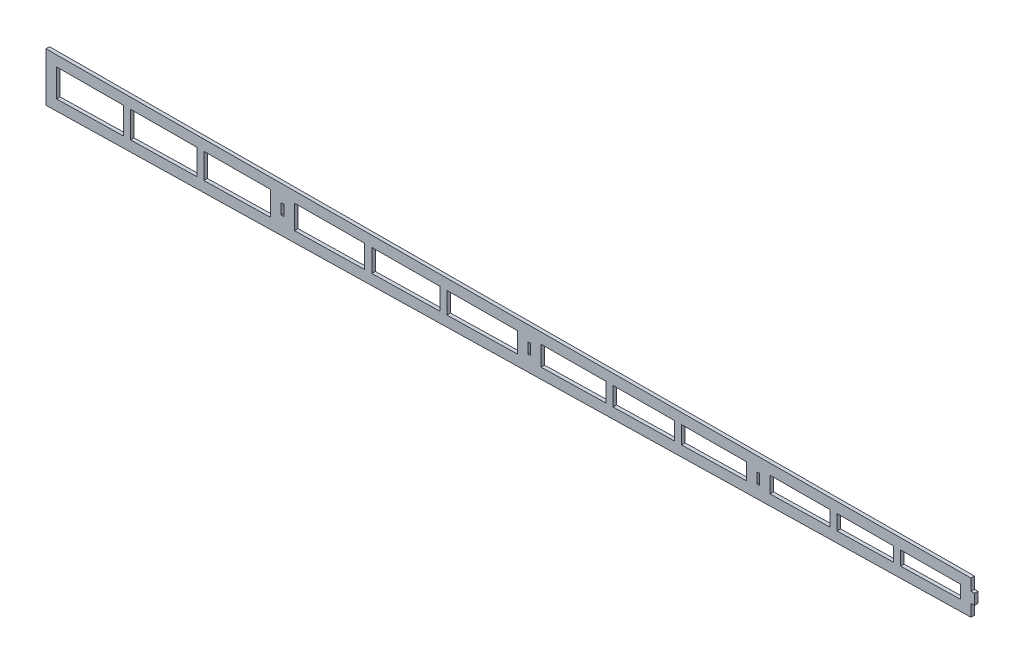
from build123d import *

# Parameters (mm, degrees)
SKETCH_1_W      = 1.499999968
SKETCH_1_H      = 6.000000011
SKETCH_1_H_2    = 6.00000001
SKETCH_1_W_2    = 1.5
SKETCH_1_H_3    = 6
EXTRUDE_1_DEPTH = 2


with BuildPart() as part:
    # 草图1 → 凸台-拉伸1 (new body)
    with BuildSketch(Plane.XY):
        Polygon((537.351209242, 34.194218327), (539.351209242, 34.194218327), (539.351209242, 28.194218337), (537.351209274, 28.194218337), (537.351209274, 21.391410378), (11.364676515, 10.534074896), (11.364676515, 38.388326082), (537.351216266, 40.712891717), align=None)
        with Locations((416.371863849, 29.143567663)):
            Rectangle(SKETCH_1_W, SKETCH_1_H, mode=Mode.SUBTRACT)
        with Locations((286.128813818, 28.050804453)):
            Rectangle(SKETCH_1_W, SKETCH_1_H_2, mode=Mode.SUBTRACT)
        with Locations((145.867074626, 26.415625273)):
            Rectangle(SKETCH_1_W_2, SKETCH_1_H_3, mode=Mode.SUBTRACT)
        Polygon((531.351209242, 34.686316456), (531.351209242, 27.268837395), (497.351863833, 26.567027983), (497.351863833, 34.536058409), align=None, mode=Mode.SUBTRACT)
        Polygon((493.351863833, 26.48446058), (461.121863833, 25.819173732), (461.121863833, 34.37594212), (493.351863833, 34.518380652), align=None, mode=Mode.SUBTRACT)
        Polygon((457.121863833, 25.736606329), (423.121863833, 25.034783405), (423.121863833, 34.208003423), (457.121863833, 34.358264363), align=None, mode=Mode.SUBTRACT)
        Polygon((409.621863833, 34.148340991), (409.621863833, 24.75611842), (372.718813802, 23.994371171), (372.718813802, 33.985250198), align=None, mode=Mode.SUBTRACT)
        Polygon((368.718813802, 23.911803768), (333.778813802, 23.190577505), (333.778813802, 33.813157228), (368.718813802, 33.967572441), align=None, mode=Mode.SUBTRACT)
        Polygon((329.778813802, 23.108010102), (292.878813802, 22.346325811), (292.878813802, 33.632402157), (329.778813802, 33.79547947), align=None, mode=Mode.SUBTRACT)
        Polygon((279.378813802, 33.572739725), (279.378813802, 22.067660826), (239.377074626, 21.241950898), (239.377074626, 33.395954463), align=None, mode=Mode.SUBTRACT)
        Polygon((235.377074626, 21.159383496), (196.617074626, 20.359305362), (196.617074626, 33.206979234), (235.377074626, 33.378276705), align=None, mode=Mode.SUBTRACT)
        Polygon((192.617074626, 20.276737959), (152.617074626, 19.451063931), (152.617074626, 33.012523901), (192.617074626, 33.189301477), align=None, mode=Mode.SUBTRACT)
        Polygon((139.117074626, 32.952861469), (139.117074626, 19.172398947), (101.114676515, 18.387959118), (101.114676515, 32.784912174), align=None, mode=Mode.SUBTRACT)
        Polygon((97.114676515, 18.305391716), (59.364676515, 17.526161852), (59.364676515, 32.600400579), (97.114676515, 32.767234416), align=None, mode=Mode.SUBTRACT)
        Polygon((55.364676515, 17.443594449), (17.364676515, 16.659204122), (17.364676515, 32.414784125), (55.364676515, 32.582722822), align=None, mode=Mode.SUBTRACT)
    extrude(amount=EXTRUDE_1_DEPTH)


solid = part.part
